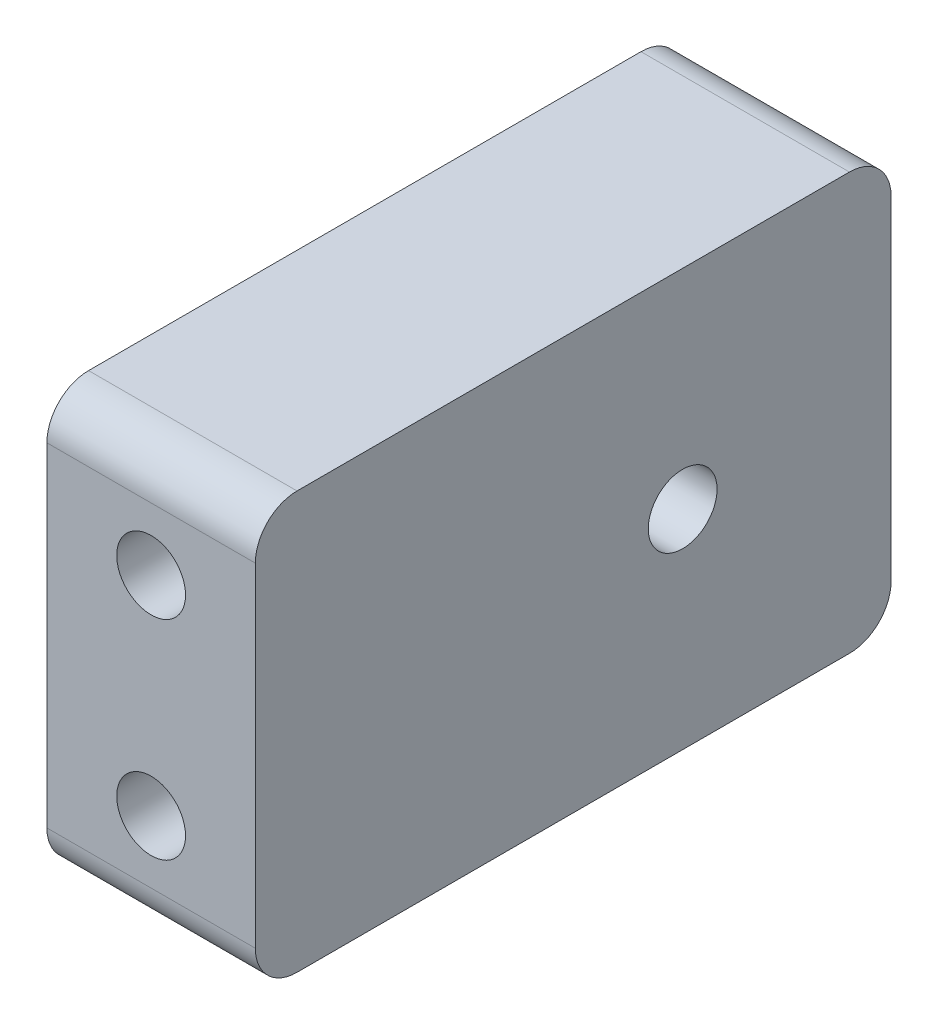
from build123d import *

# Parameters (mm, degrees)
SKETCH_1_W      = 30.5
SKETCH_1_H      = 20
SKETCH_1_R      = 1.65
EXTRUDE_1_DEPTH = 10
M4X0_7_1_D      = 3.3
M4X0_7_1_DEPTH  = 15
M4X0_7_1_TIP    = 0.991420021
FILLET_1_R      = 2


with BuildPart() as part:
    # ｽｹｯﾁ1 → ﾎﾞｽ - 押し出し1 (new body)
    with BuildSketch(Plane(origin=(0, 0, 0), x_dir=(0, 0, -1), z_dir=(1, 0, 0))):
        with Locations((15.25, 10)):
            Rectangle(SKETCH_1_W, SKETCH_1_H)
        with Locations((20.5, 10)):
            Circle(SKETCH_1_R, mode=Mode.SUBTRACT)
    extrude(amount=EXTRUDE_1_DEPTH)

    # M4x0.7 ねじ穴1
    with Locations(Plane.XY):
        with Locations((5, 5), (5, 15)):
            Hole(M4X0_7_1_D / 2, depth=M4X0_7_1_DEPTH)
            with Locations((0, 0, -(M4X0_7_1_DEPTH + M4X0_7_1_TIP / 2))):  # 118° drill point
                Cone(0, M4X0_7_1_D / 2, M4X0_7_1_TIP, mode=Mode.SUBTRACT)

    # ﾌｨﾚｯﾄ1
    fillet_1_edges = [part.edges().sort_by_distance(p)[0] for p in [
        (5, 20, 0),
        (5, 20, -30.5),
        (5, 0, -30.5),
        (5, 0, 0),
    ]]
    fillet(fillet_1_edges, radius=FILLET_1_R)


solid = part.part
